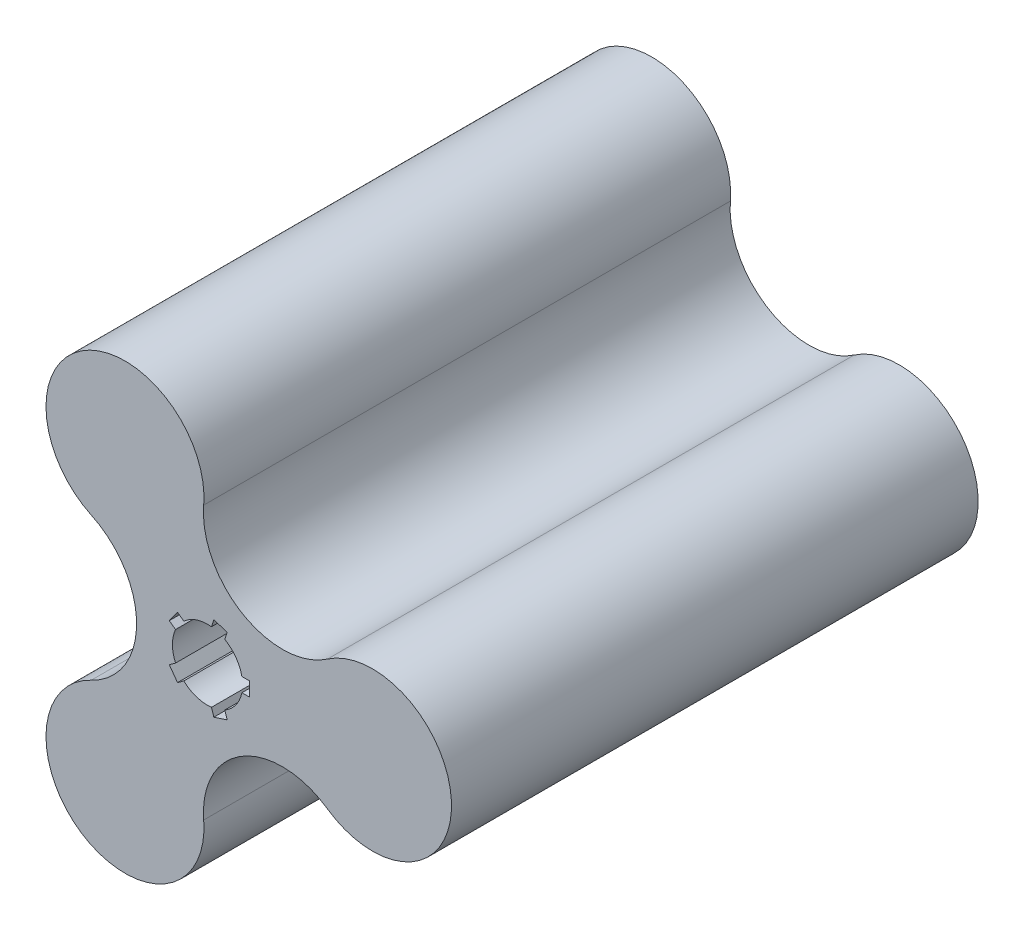
from build123d import *

# Parameters (mm, degrees)
BOSS_EXTRUDE1_DEPTH = 150
CUT_EXTRUDE1_DEPTH  = 177.988399984


with BuildPart() as part:
    # Sketch1 → Boss-Extrude1 (new body)
    with BuildSketch(Plane.XY):
        with BuildLine():
            ThreePointArc((34.172460266, -18.485243422), (69.5, 0), (34.172460266, 18.485243422))
            ThreePointArc((34.172460266, 18.485243422), (10.094920531, 17.484915258), (-1.077539734, 38.836840411))
            ThreePointArc((-1.077539734, 38.836840411), (-34.75, 60.188765563), (-33.094920531, 20.351596989))
            ThreePointArc((-33.094920531, 20.351596989), (-20.189841062, 0), (-33.094920531, -20.351596989))
            ThreePointArc((-33.094920531, -20.351596989), (-34.75, -60.188765563), (-1.077539734, -38.836840411))
            ThreePointArc((-1.077539734, -38.836840411), (10.094920531, -17.484915258), (34.172460266, -18.485243422))
        make_face()
    extrude(amount=-BOSS_EXTRUDE1_DEPTH)

    # Sketch2 → Cut-Extrude1 (cut, through all)
    with BuildSketch(Plane.XY):
        with BuildLine():
            Line((9.797958971, 2), (12, 2))
            Line((12, 2), (12, -2))
            Line((12, -2), (9.797958971, -2))
            ThreePointArc((9.797958971, -2), (8.090169944, -5.877852523), (4.929848865, -8.700378737))
            Line((4.929848865, -8.700378737), (5.610316965, -10.794644207))
            Line((5.610316965, -10.794644207), (1.8060909, -12.030712184))
            Line((1.8060909, -12.030712184), (1.1256228, -9.936446715))
            ThreePointArc((1.1256228, -9.936446715), (-3.090169944, -9.510565163), (-6.751144813, -7.377129775))
            Line((-6.751144813, -7.377129775), (-8.532633428, -8.671457016))
            Line((-8.532633428, -8.671457016), (-10.883774437, -5.435389039))
            Line((-10.883774437, -5.435389039), (-9.102285822, -4.141061797))
            ThreePointArc((-9.102285822, -4.141061797), (-10, 0), (-9.102285822, 4.141061797))
            Line((-9.102285822, 4.141061797), (-10.883774437, 5.435389039))
            Line((-10.883774437, 5.435389039), (-8.532633428, 8.671457016))
            Line((-8.532633428, 8.671457016), (-6.751144813, 7.377129775))
            ThreePointArc((-6.751144813, 7.377129775), (-3.090169944, 9.510565163), (1.1256228, 9.936446715))
            Line((1.1256228, 9.936446715), (1.8060909, 12.030712184))
            Line((1.8060909, 12.030712184), (5.610316965, 10.794644207))
            Line((5.610316965, 10.794644207), (4.929848865, 8.700378737))
            ThreePointArc((4.929848865, 8.700378737), (8.090169944, 5.877852523), (9.797958971, 2))
        make_face()
    extrude(amount=-CUT_EXTRUDE1_DEPTH, mode=Mode.SUBTRACT)


solid = part.part
